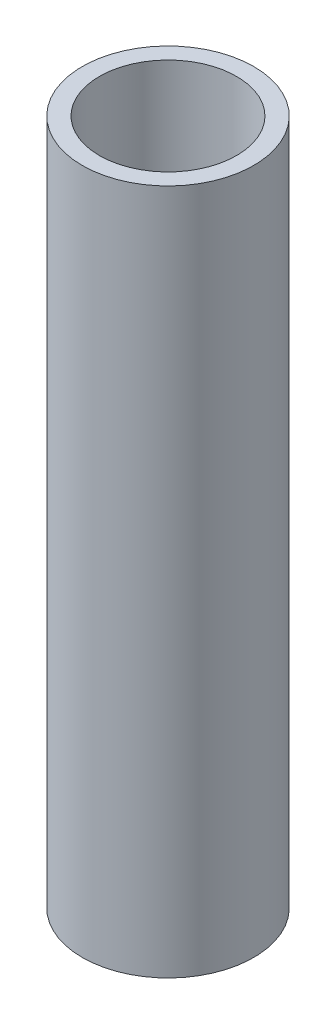
from build123d import *

# Parameters (mm, degrees)
SKETCH1_R           = 12.5
SKETCH1_R_2         = 10
BOSS_EXTRUDE1_DEPTH = 100


with BuildPart() as part:
    # Sketch1 → Boss-Extrude1 (new body)
    with BuildSketch(Plane(origin=(0, 0, 0), x_dir=(1, 0, 0), z_dir=(0, 1, 0))):
        with Locations(Location((0, 0, 0), (0, 0, 270))):
            Circle(SKETCH1_R)
        with Locations(Location((0, 0, 0), (0, 0, 270))):
            Circle(SKETCH1_R_2, mode=Mode.SUBTRACT)
    extrude(amount=BOSS_EXTRUDE1_DEPTH)


solid = part.part
